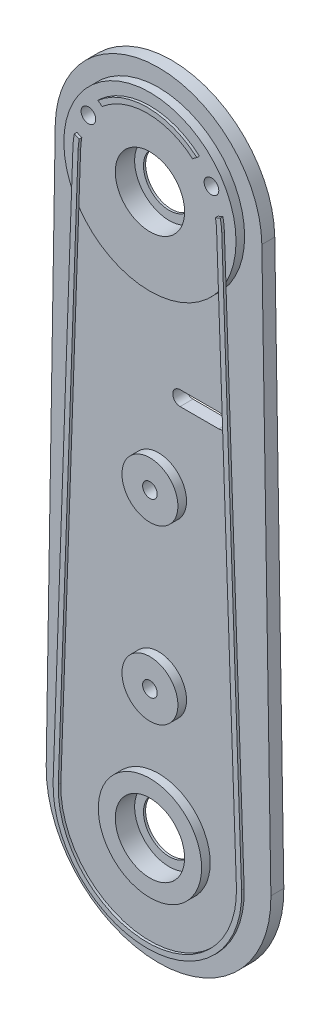
from build123d import *

# Parameters (mm, degrees)
SKETCH1_R           = 6
SKETCH1_R_2         = 1.7
BOSS_EXTRUDE1_DEPTH = 3
SKETCH2_R           = 20
SKETCH2_R_2         = 6
SKETCH2_R_3         = 1.7
BOSS_EXTRUDE2_DEPTH = 2
SKETCH3_R           = 12
SKETCH3_R_2         = 6
BOSS_EXTRUDE3_DEPTH = 2
SKETCH4_R           = 6.5
SKETCH4_R_2         = 1.7
BOSS_EXTRUDE4_DEPTH = 2
SKETCH5_R           = 6.5
SKETCH5_R_2         = 1.7
BOSS_EXTRUDE5_DEPTH = 2
BOSS_EXTRUDE6_DEPTH = 0.6
SKETCH7_R           = 5.45
CUT_EXTRUDE1_DEPTH  = 0.6
SKETCH8_R           = 8.05
CUT_EXTRUDE2_DEPTH  = 4.5
SKETCH9_R           = 3.75
CUT_EXTRUDE3_DEPTH  = 2.3


with BuildPart() as part:
    # Sketch1 → Boss-Extrude1 (new body)
    with BuildSketch(Plane.XY.offset(328.5)):
        with BuildLine():
            Line((276.003127371, 300.387432585), (273.904807661, 170.421310226))
            ThreePointArc((273.904807661, 170.421310226), (300, 143.901406829), (326.095192339, 170.421310226))
            Line((326.095192339, 170.421310226), (323.996872629, 300.387432585))
            ThreePointArc((323.996872629, 300.387432585), (300, 324), (276.003127371, 300.387432585))
        make_face()
        with Locations((300, 300)):
            Circle(SKETCH1_R, mode=Mode.SUBTRACT)
        with Locations((300, 170)):
            Circle(SKETCH1_R, mode=Mode.SUBTRACT)
        with Locations((314.289419162, 308.25)):
            Circle(SKETCH1_R_2, mode=Mode.SUBTRACT)
        with Locations((285.710580838, 308.25)):
            Circle(SKETCH1_R_2, mode=Mode.SUBTRACT)
        with Locations((300, 240)):
            Circle(SKETCH1_R_2, mode=Mode.SUBTRACT)
        with Locations((300, 200)):
            Circle(SKETCH1_R_2, mode=Mode.SUBTRACT)
        with BuildLine():
            Line((305, 258.3), (314, 258.3))
            ThreePointArc((314, 258.3), (315.7, 260), (314, 261.7))
            Line((314, 261.7), (305, 261.7))
            ThreePointArc((305, 261.7), (303.3, 260), (305, 258.3))
        make_face(mode=Mode.SUBTRACT)
    extrude(amount=BOSS_EXTRUDE1_DEPTH)

    # Sketch2 → Boss-Extrude2 (add)
    with BuildSketch(Plane.XY.offset(331.5)):
        with Locations((300, 300)):
            Circle(SKETCH2_R)
        with Locations((300, 300)):
            Circle(SKETCH2_R_2, mode=Mode.SUBTRACT)
        with Locations((314.289419162, 308.25)):
            Circle(SKETCH2_R_3, mode=Mode.SUBTRACT)
        with Locations((285.710580838, 308.25)):
            Circle(SKETCH2_R_3, mode=Mode.SUBTRACT)
    extrude(amount=BOSS_EXTRUDE2_DEPTH)

    # Sketch3 → Boss-Extrude3 (add)
    with BuildSketch(Plane.XY.offset(331.5)):
        with Locations((300, 170)):
            Circle(SKETCH3_R)
        with Locations((300, 170)):
            Circle(SKETCH3_R_2, mode=Mode.SUBTRACT)
    extrude(amount=BOSS_EXTRUDE3_DEPTH)

    # Sketch4 → Boss-Extrude4 (add)
    with BuildSketch(Plane.XY.offset(331.5)):
        with Locations((300, 240)):
            Circle(SKETCH4_R)
        with Locations((300, 240)):
            Circle(SKETCH4_R_2, mode=Mode.SUBTRACT)
    extrude(amount=BOSS_EXTRUDE4_DEPTH)

    # Sketch5 → Boss-Extrude5 (add)
    with BuildSketch(Plane.XY.offset(331.5)):
        with Locations((300, 200)):
            Circle(SKETCH5_R)
        with Locations((300, 200)):
            Circle(SKETCH5_R_2, mode=Mode.SUBTRACT)
    extrude(amount=BOSS_EXTRUDE5_DEPTH)

    # Sketch6 → Boss-Extrude6 (add)
    with BuildSketch(Plane.XY.offset(333.5)):
        with BuildLine():
            Line((282.710827179, 300.61196663), (278.11511203, 170.774636315))
            ThreePointArc((278.11511203, 170.774636315), (300, 148.101406829), (321.88488797, 170.774636315))
            Line((321.88488797, 170.774636315), (317.289172821, 300.61196663))
            ThreePointArc((317.289172821, 300.61196663), (300, 317.3), (282.710827179, 300.61196663))
        make_face()
        with BuildLine():
            Line((283.910076161, 300.569518077), (279.314361012, 170.732187763))
            ThreePointArc((279.314361012, 170.732187763), (300, 149.301406829), (320.685638988, 170.732187763))
            Line((320.685638988, 170.732187763), (316.089923839, 300.569518077))
            ThreePointArc((316.089923839, 300.569518077), (300, 316.1), (283.910076161, 300.569518077))
        make_face(mode=Mode.SUBTRACT)
    extrude(amount=BOSS_EXTRUDE6_DEPTH)

    # Sketch7 → Cut-Extrude1 (cut)
    with BuildSketch(Plane.XY.offset(333.5)):
        with Locations((314.289419162, 308.25)):
            Circle(SKETCH7_R)
        with Locations((285.710580838, 308.25)):
            Circle(SKETCH7_R)
    extrude(amount=CUT_EXTRUDE1_DEPTH, mode=Mode.SUBTRACT)

    # Sketch8 → Cut-Extrude2 (cut)
    with BuildSketch(Plane.XY.offset(329)):
        with Locations((300, 300)):
            Circle(SKETCH8_R)
        with Locations((300, 170)):
            Circle(SKETCH8_R)
    extrude(amount=CUT_EXTRUDE2_DEPTH, mode=Mode.SUBTRACT)

    # Sketch9 → Cut-Extrude3 (cut)
    with BuildSketch(Plane.XY.offset(328.5)):
        with Locations((314.289419162, 308.25)):
            Circle(SKETCH9_R)
        with Locations((285.710580838, 308.25)):
            Circle(SKETCH9_R)
        with Locations((300, 240)):
            Circle(SKETCH9_R)
        with Locations((300, 200)):
            Circle(SKETCH9_R)
    extrude(amount=CUT_EXTRUDE3_DEPTH, mode=Mode.SUBTRACT)


solid = part.part
